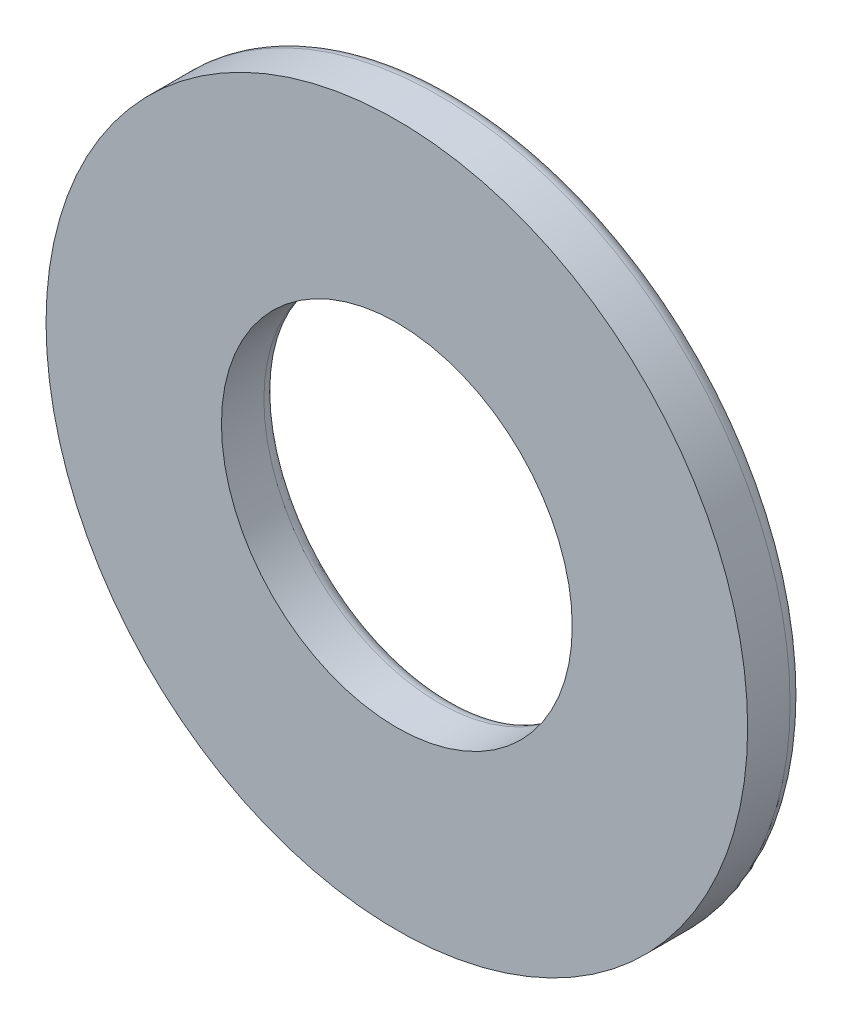
from build123d import *

# Parameters (mm, degrees)
BOSS_EXTRUDE1_DEPTH      = 0.83185
BOSS_EXTRUDE1_DEPTH_BACK = 0.83185
SKETCH3_R                = 10.3124
SKETCH3_R_2              = 5.1562
FILLET1_R                = 0.415925


with BuildPart() as part:
    # Sketch3 → Boss-Extrude1 (new, two sides: drawn at the far end of the back side and taken through both)
    with BuildSketch(Plane.XY.offset(-BOSS_EXTRUDE1_DEPTH_BACK)):
        with Locations(Location((0, 0, 0), (0, 0, 180))):
            Circle(SKETCH3_R)
        with Locations(Location((0, 0, 0), (0, 0, 180))):
            Circle(SKETCH3_R_2, mode=Mode.SUBTRACT)
    extrude(amount=BOSS_EXTRUDE1_DEPTH + BOSS_EXTRUDE1_DEPTH_BACK)

    # Fillet1
    fillet1_edges = [part.edges().sort_by_distance(p)[0] for p in [
        (10.3124, 0, -0.83185),
        (5.1562, 0, -0.83185),
    ]]
    fillet(fillet1_edges, radius=FILLET1_R)


solid = part.part
